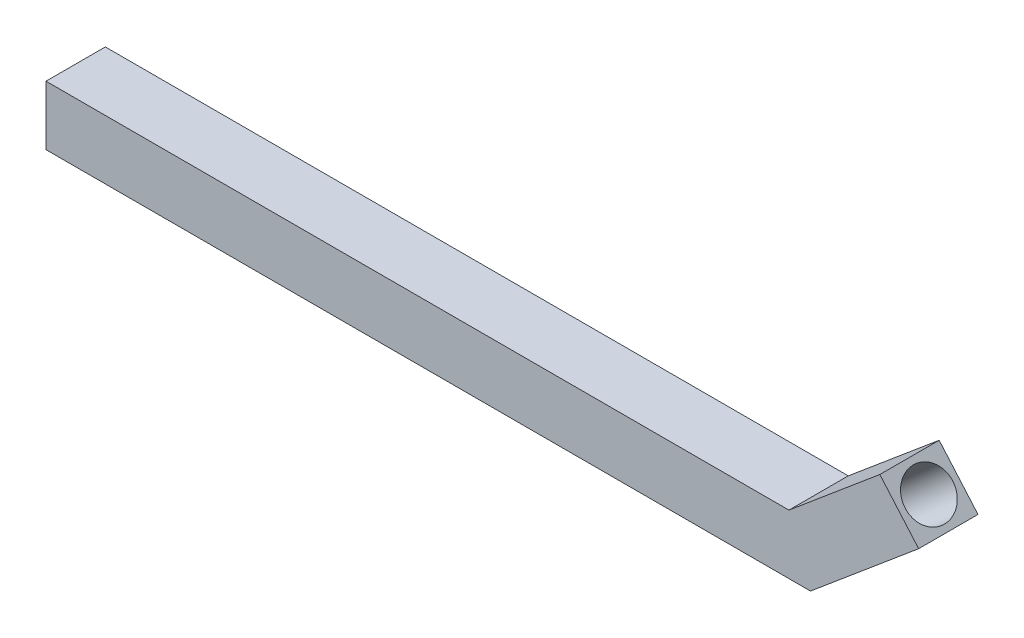
from build123d import *

# Parameters (mm, degrees)
BOSS_EXTRUDE1_DEPTH = 2.5
SKETCH2_R           = 1
CUT_EXTRUDE1_DEPTH  = 5
SKETCH3_R           = 1
CUT_EXTRUDE2_DEPTH  = 5
SKETCH4_R           = 1
BOSS_EXTRUDE2_DEPTH = 5
SKETCH6_W           = 2.5
SKETCH6_H           = 2.5
BOSS_EXTRUDE3_DEPTH = 25
SKETCH7_R           = 1
CUT_EXTRUDE3_DEPTH  = 5
SKETCH8_W           = 8
SKETCH8_H           = 2.5
CUT_EXTRUDE4_DEPTH  = 10
SKETCH9_R           = 1
CUT_EXTRUDE5_DEPTH  = 5
SKETCH10_R          = 1
BOSS_EXTRUDE4_DEPTH = 5
SKETCH11_W          = 2.5
SKETCH11_H          = 2.5
BOSS_EXTRUDE5_DEPTH = 1
SKETCH12_W          = 2.5
SKETCH12_H          = 2.5
BOSS_EXTRUDE6_DEPTH = 1
SKETCH13_W          = 2.5
SKETCH13_H          = 2.5
CUT_EXTRUDE6_DEPTH  = 1
CUT_EXTRUDE7_DEPTH  = 5


with BuildPart() as part:
    # Sketch1 → Boss-Extrude1 (new body)
    with BuildSketch(Plane.XY):
        Polygon((-13.3, 0), (0, 0), (3.830222216, 3.213938048), (5.465982834, 1.323359513), (0.909480399, -2.5), (-13.3, -2.5), align=None)
    extrude(amount=BOSS_EXTRUDE1_DEPTH)

    # Sketch2 → Cut-Extrude1 (cut)
    with BuildSketch(Plane(origin=(3.780724263, 3.271146765, 0), x_dir=(0, 0, -1), z_dir=(0.7562314141303861, 0.6543042474891605, 0))):
        with Locations(Location((-1.25, -1.325649749, 0), (0, 0, 90))):
            Circle(SKETCH2_R)
    extrude(amount=-CUT_EXTRUDE1_DEPTH, mode=Mode.SUBTRACT)

    # Sketch3 → Cut-Extrude2 (cut)
    with BuildSketch(Plane.ZY.offset(13.3)):
        with Locations((1.25, -1.25)):
            Circle(SKETCH3_R)
    extrude(amount=-CUT_EXTRUDE2_DEPTH, mode=Mode.SUBTRACT)

    # Sketch4 → Boss-Extrude2 (add)
    with BuildSketch(Plane.ZY.offset(13.3)):
        with Locations((1.25, -1.25)):
            Circle(SKETCH4_R)
    extrude(amount=-BOSS_EXTRUDE2_DEPTH)

    # Sketch6 → Boss-Extrude3 (add)
    with BuildSketch(Plane.ZY.offset(13.3)):
        with Locations((1.25, -1.25)):
            Rectangle(SKETCH6_W, SKETCH6_H)
    extrude(amount=BOSS_EXTRUDE3_DEPTH)

    # Sketch7 → Cut-Extrude3 (cut)
    with BuildSketch(Plane.ZY.offset(38.3)):
        with Locations((1.25, -1.25)):
            Circle(SKETCH7_R)
    extrude(amount=-CUT_EXTRUDE3_DEPTH, mode=Mode.SUBTRACT)

    # Sketch8 → Cut-Extrude4 (cut)
    with BuildSketch(Plane(origin=(0, 0, 0), x_dir=(-1, 0, 0), z_dir=(0, 0, -1))):
        with Locations((34.3, -1.25)):
            Rectangle(SKETCH8_W, SKETCH8_H)
    extrude(amount=-CUT_EXTRUDE4_DEPTH, mode=Mode.SUBTRACT)

    # Sketch9 → Cut-Extrude5 (cut)
    with BuildSketch(Plane.ZY.offset(30.3)):
        with Locations((1.25, -1.25)):
            Circle(SKETCH9_R)
    extrude(amount=-CUT_EXTRUDE5_DEPTH, mode=Mode.SUBTRACT)

    # Sketch10 → Boss-Extrude4 (add)
    with BuildSketch(Plane.ZY.offset(30.3)):
        with Locations((1.25, -1.25)):
            Circle(SKETCH10_R)
    extrude(amount=-BOSS_EXTRUDE4_DEPTH)

    # Sketch11 → Boss-Extrude5 (add)
    with BuildSketch(Plane.ZY.offset(30.3)):
        with Locations((1.25, -1.25)):
            Rectangle(SKETCH11_W, SKETCH11_H)
    extrude(amount=BOSS_EXTRUDE5_DEPTH)

    # Sketch12 → Boss-Extrude6 (add)
    with BuildSketch(Plane.ZY.offset(31.3)):
        with Locations((1.25, -1.25)):
            Rectangle(SKETCH12_W, SKETCH12_H)
    extrude(amount=BOSS_EXTRUDE6_DEPTH)

    # Sketch13 → Cut-Extrude6 (cut)
    with BuildSketch(Plane.ZY.offset(32.3)):
        with Locations((1.25, -1.25)):
            Rectangle(SKETCH13_W, SKETCH13_H)
    extrude(amount=-CUT_EXTRUDE6_DEPTH, mode=Mode.SUBTRACT)

    # Sketch14 → Cut-Extrude7 (cut)
    with BuildSketch(Plane.ZY.offset(31.3)):
        with BuildLine():
            ThreePointArc((2.25, -1.25), (1.25, -0.25), (0.25, -1.25))
            Line((0.25, -1.25), (2.25, -1.25))
        make_face()
        with BuildLine():
            Line((2.25, -1.25), (0.25, -1.25))
            ThreePointArc((0.25, -1.25), (1.25, -2.25), (2.25, -1.25))
        make_face()
    extrude(amount=-CUT_EXTRUDE7_DEPTH, mode=Mode.SUBTRACT)


solid = part.part
